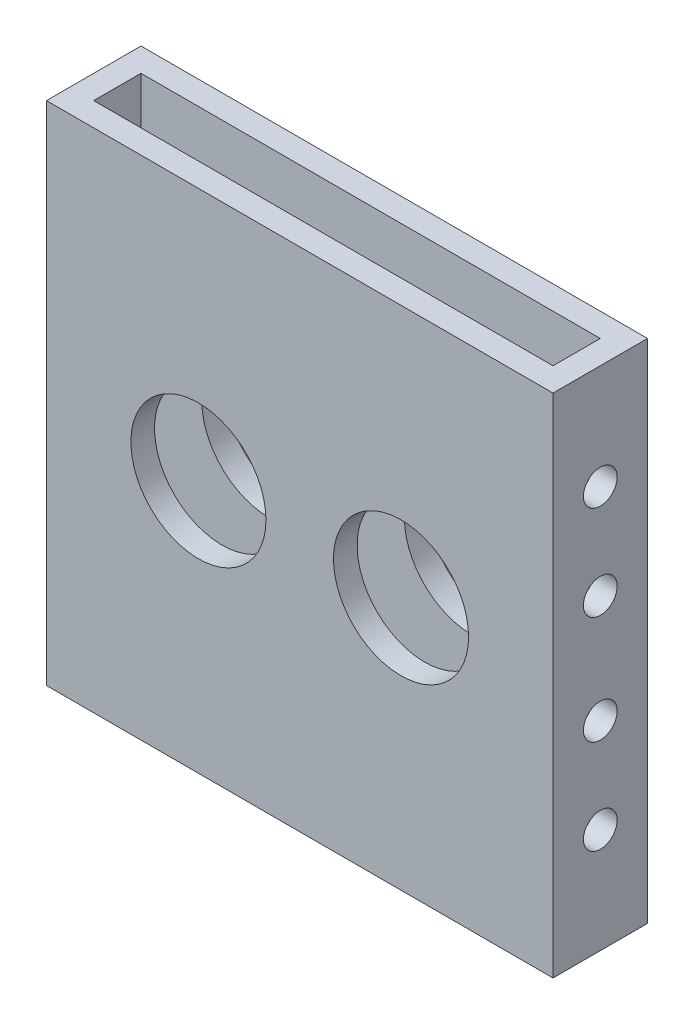
from build123d import *

# Parameters (mm, degrees)
SKETCH1_W           = 95.25
SKETCH1_H           = 95.25
BOSS_EXTRUDE1_DEPTH = 17.78
SKETCH2_W           = 86.36
SKETCH2_H           = 8.89
CUT_EXTRUDE1_DEPTH  = 108.966807515
SKETCH3_R           = 12.7
CUT_EXTRUDE2_DEPTH  = 70.659239516
SKETCH4_R           = 3.175
CUT_EXTRUDE3_DEPTH  = 108.966807515


with BuildPart() as part:
    # Sketch1 → Boss-Extrude1 (new body)
    with BuildSketch(Plane.XY):
        Rectangle(SKETCH1_W, SKETCH1_H)
    extrude(amount=-BOSS_EXTRUDE1_DEPTH)

    # Sketch2 → Cut-Extrude1 (cut, through all)
    with BuildSketch(Plane(origin=(0, 47.625, 0), x_dir=(1, 0, 0), z_dir=(0, 1, 0))):
        with Locations((0, 8.89)):
            Rectangle(SKETCH2_W, SKETCH2_H)
    extrude(amount=-CUT_EXTRUDE1_DEPTH, mode=Mode.SUBTRACT)

    # Sketch3 → Cut-Extrude2 (cut, through all)
    with BuildSketch(Plane.XY):
        with Locations((19.05, 0)):
            Circle(SKETCH3_R)
        with Locations((-19.05, 0)):
            Circle(SKETCH3_R)
    extrude(amount=-CUT_EXTRUDE2_DEPTH, mode=Mode.SUBTRACT)

    # Sketch4 → Cut-Extrude3 (cut, through all)
    with BuildSketch(Plane(origin=(47.625, 0, 0), x_dir=(0, 0, -1), z_dir=(1, 0, 0))):
        with Locations((8.89, 10.16)):
            Circle(SKETCH4_R)
        with Locations((8.89, -10.16)):
            Circle(SKETCH4_R)
        with Locations((8.89, -27.94)):
            Circle(SKETCH4_R)
        with Locations((8.89, 27.94)):
            Circle(SKETCH4_R)
    extrude(amount=-CUT_EXTRUDE3_DEPTH, mode=Mode.SUBTRACT)


solid = part.part
